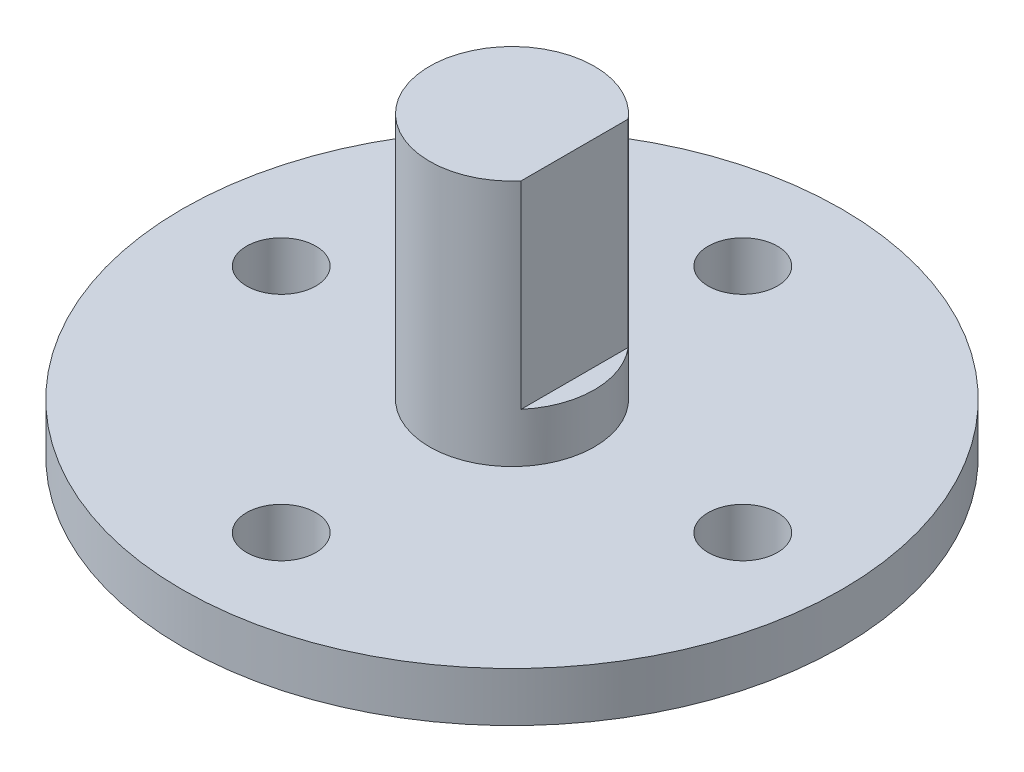
from build123d import *

# Parameters (mm, degrees)
SKETCH1_R           = 20
SKETCH1_R_2         = 2.1
BOSS_EXTRUDE1_DEPTH = 3
SKETCH2_R           = 5
BOSS_EXTRUDE2_DEPTH = 15
CUT_EXTRUDE1_START  = -12
CUT_EXTRUDE1_DEPTH  = 12


with BuildPart() as part:
    # Sketch1 → Boss-Extrude1 (new body)
    with BuildSketch(Plane(origin=(0, 0, 0), x_dir=(1, 0, 0), z_dir=(0, 1, 0))):
        with Locations(Location((0, 0, 0), (0, 0, 270))):
            Circle(SKETCH1_R)
        with Locations(Location((-14, 0, 0), (0, 0, 270))):
            Circle(SKETCH1_R_2, mode=Mode.SUBTRACT)
        with Locations(Location((0, 14, 0), (0, 0, 270))):
            Circle(SKETCH1_R_2, mode=Mode.SUBTRACT)
        with Locations(Location((14, 0, 0), (0, 0, 270))):
            Circle(SKETCH1_R_2, mode=Mode.SUBTRACT)
        with Locations(Location((0, -14, 0), (0, 0, 270))):
            Circle(SKETCH1_R_2, mode=Mode.SUBTRACT)
    extrude(amount=BOSS_EXTRUDE1_DEPTH)

    # Sketch2 → Boss-Extrude2 (add)
    with BuildSketch(Plane(origin=(0, 3, 0), x_dir=(1, 0, 0), z_dir=(0, 1, 0))):
        with Locations(Location((0, 0, 0), (0, 0, 270))):
            Circle(SKETCH2_R)
    extrude(amount=BOSS_EXTRUDE2_DEPTH)

    # Sketch3 → Cut-Extrude1 (cut)
    with BuildSketch(Plane(origin=(0, 18, 0), x_dir=(1, 0, 0), z_dir=(0, 1, 0)).offset(CUT_EXTRUDE1_START)):
        with BuildLine():
            Line((3.8, 3.249615362), (3.8, -3.249615362))
            ThreePointArc((3.8, -3.249615362), (5, 0), (3.8, 3.249615362))
        make_face()
    extrude(amount=CUT_EXTRUDE1_DEPTH, mode=Mode.SUBTRACT)


solid = part.part
